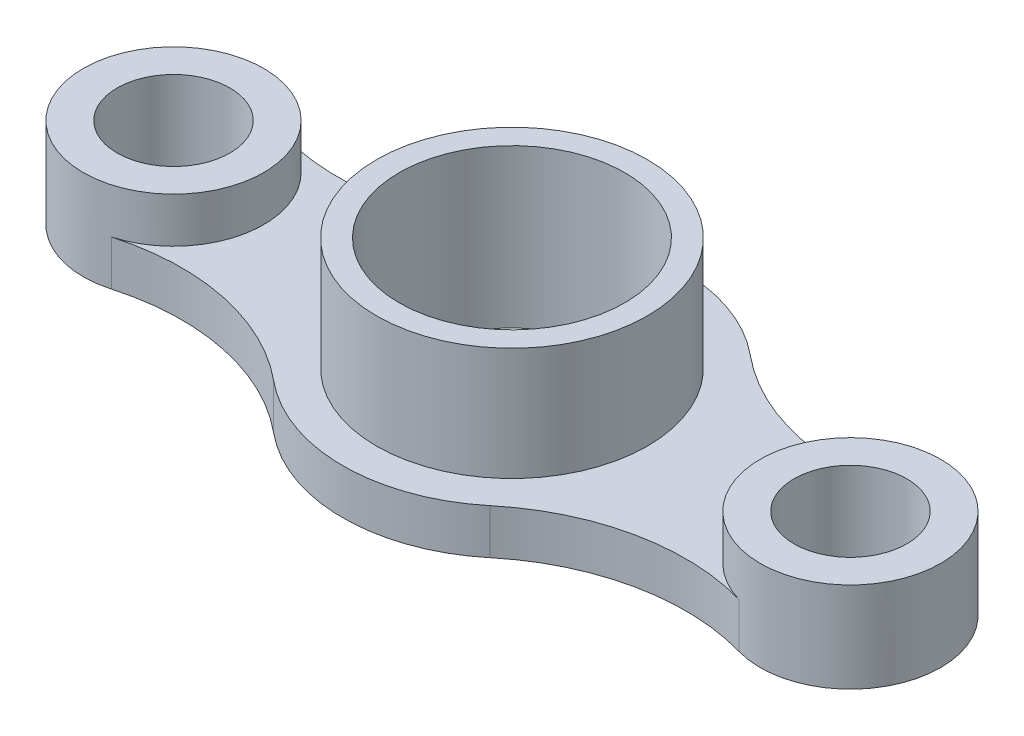
from build123d import *

# Parameters (mm, degrees)
SKETCH2_R             = 40
SKETCH2_R_2           = 25
BOSS_EXTRUDE2_DEPTH   = 40
BOSS_EXTRUDE2_2_DEPTH = 40
SKETCH2_4_R           = 60
SKETCH2_4_R_2         = 50
BOSS_EXTRUDE3_DEPTH   = 70
SKETCH2_5_R           = 60
BOSS_EXTRUDE4_DEPTH   = 20


with BuildPart() as part:
    # Sketch2 → Boss-Extrude2 (new body)
    with BuildSketch(Plane(origin=(0, 0, 0), x_dir=(1, 0, 0), z_dir=(0, 1, 0))):
        with Locations((-150, 0)):
            Circle(SKETCH2_R)
        with Locations((-150, 0)):
            Circle(SKETCH2_R_2, mode=Mode.SUBTRACT)
    extrude(amount=BOSS_EXTRUDE2_DEPTH)



with BuildPart() as body_2:
    # Sketch2 → Boss-Extrude2 2 (new body)
    with BuildSketch(Plane(origin=(0, 0, 0), x_dir=(1, 0, 0), z_dir=(0, 1, 0))):
        with Locations((150, 0)):
            Circle(SKETCH2_R)
        with Locations((150, 0)):
            Circle(SKETCH2_R_2, mode=Mode.SUBTRACT)
    extrude(amount=BOSS_EXTRUDE2_2_DEPTH)


with BuildPart() as body_3:
    # Sketch2<4> → Boss-Extrude3 (new body)
    with BuildSketch(Plane(origin=(0, 0, 0), x_dir=(1, 0, 0), z_dir=(0, 1, 0))):
        Circle(SKETCH2_4_R)
        Circle(SKETCH2_4_R_2, mode=Mode.SUBTRACT)
    extrude(amount=BOSS_EXTRUDE3_DEPTH)


with BuildPart() as part_1:
    add(part.part)

    add(body_2.part)  # Boss-Extrude4 merges body 2

    add(body_3.part)  # Boss-Extrude4 merges body 3
    # Sketch2<5> → Boss-Extrude4 (add)
    with BuildSketch(Plane(origin=(0, 0, 0), x_dir=(1, 0, 0), z_dir=(0, 1, 0))):
        with BuildLine():
            ThreePointArc((-139.071428571, -38.478127898), (-91.104177178, -36.827906099), (-47.892857143, -57.717191847))
            ThreePointArc((-47.892857143, -57.717191847), (0, -75), (47.892857143, -57.717191847))
            ThreePointArc((47.892857143, -57.717191847), (91.104177178, -36.827906099), (139.071428571, -38.478127898))
            ThreePointArc((139.071428571, -38.478127898), (110, 0), (139.071428571, 38.478127898))
            ThreePointArc((139.071428571, 38.478127898), (91.104177178, 36.827906099), (47.892857143, 57.717191847))
            ThreePointArc((47.892857143, 57.717191847), (0, 75), (-47.892857143, 57.717191847))
            ThreePointArc((-47.892857143, 57.717191847), (-91.104177178, 36.827906099), (-139.071428571, 38.478127898))
            ThreePointArc((-139.071428571, 38.478127898), (-118.084934144, 24.112830017), (-110, 0))
            ThreePointArc((-110, 0), (-118.084934144, -24.112830017), (-139.071428571, -38.478127898))
        make_face()
        Circle(SKETCH2_5_R, mode=Mode.SUBTRACT)
    extrude(amount=BOSS_EXTRUDE4_DEPTH)


solid = part_1.part
